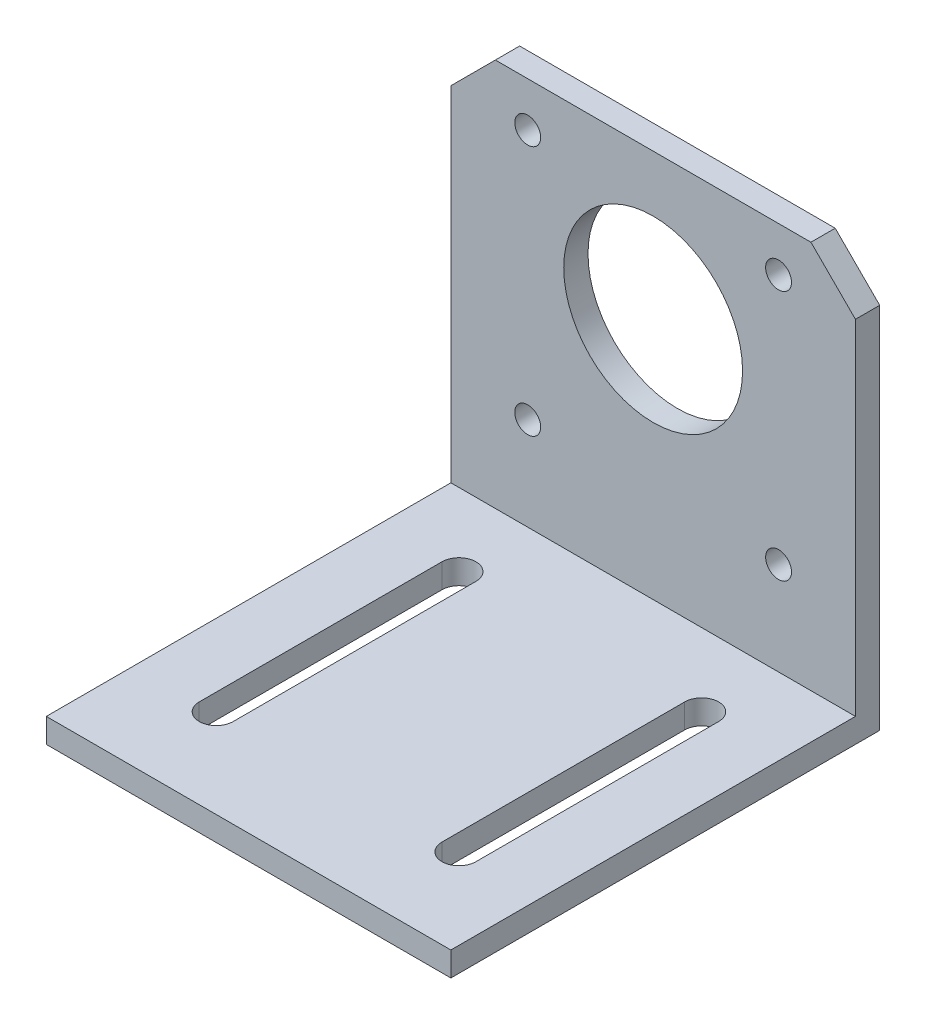
from build123d import *

# Parameters (mm, degrees)
SKETCH_1_W          = 53
SKETCH_1_H          = 51
EXTRUDE_1_DEPTH     = 50
SKETCH_2_W          = 50
SKETCH_2_H          = 48
CUT_EXTRUDE_1_DEPTH = 50
CUT_EXTRUDE_2_DEPTH = 25
SKETCH_4_R          = 11.05
SKETCH_4_R_2        = 1.6
CUT_EXTRUDE_3_DEPTH = 50


with BuildPart() as part:
    # 草图1 → 凸台-拉伸1 (new body)
    with BuildSketch(Plane(origin=(0, 0, 0), x_dir=(0, 0, -1), z_dir=(1, 0, 0))):
        with Locations((26.5, 25.5)):
            Rectangle(SKETCH_1_W, SKETCH_1_H)
    extrude(amount=EXTRUDE_1_DEPTH)

    # 草图2 → 切除-拉伸1 (cut)
    with BuildSketch(Plane.ZY):
        with Locations((-25, 27)):
            Rectangle(SKETCH_2_W, SKETCH_2_H)
    extrude(amount=-CUT_EXTRUDE_1_DEPTH, mode=Mode.SUBTRACT)

    # 草图3 → 切除-拉伸2 (cut, symmetric)
    with BuildSketch(Plane(origin=(0, 3, 0), x_dir=(1, 0, 0), z_dir=(0, 1, 0))):
        with BuildLine():
            Line((7.9, 41), (7.9, 11))
            ThreePointArc((7.9, 11), (10, 8.9), (12.1, 11))
            Line((12.1, 11), (12.1, 41))
            ThreePointArc((12.1, 41), (10, 43.1), (7.9, 41))
        make_face()
        with BuildLine():
            Line((37.9, 41), (37.9, 11))
            ThreePointArc((37.9, 11), (40, 8.9), (42.1, 11))
            Line((42.1, 11), (42.1, 41))
            ThreePointArc((42.1, 41), (40, 43.1), (37.9, 41))
        make_face()
    extrude(amount=CUT_EXTRUDE_2_DEPTH, both=True, mode=Mode.SUBTRACT)

    # 草图4 → 切除-拉伸3 (cut)
    with BuildSketch(Plane.XY.offset(-50)):
        with Locations((25, 33)):
            Circle(SKETCH_4_R)
        with Locations((9.5, 45.5)):
            Circle(SKETCH_4_R_2)
        with Locations((40.5, 45.5)):
            Circle(SKETCH_4_R_2)
        with Locations((9.5, 14.5)):
            Circle(SKETCH_4_R_2)
        with Locations((40.5, 14.5)):
            Circle(SKETCH_4_R_2)
        Polygon((5.5, 51), (0, 45.5), (0, 51), align=None)
        Polygon((44.5, 51), (50, 45.5), (50, 51), align=None)
    extrude(amount=-CUT_EXTRUDE_3_DEPTH, mode=Mode.SUBTRACT)


solid = part.part
